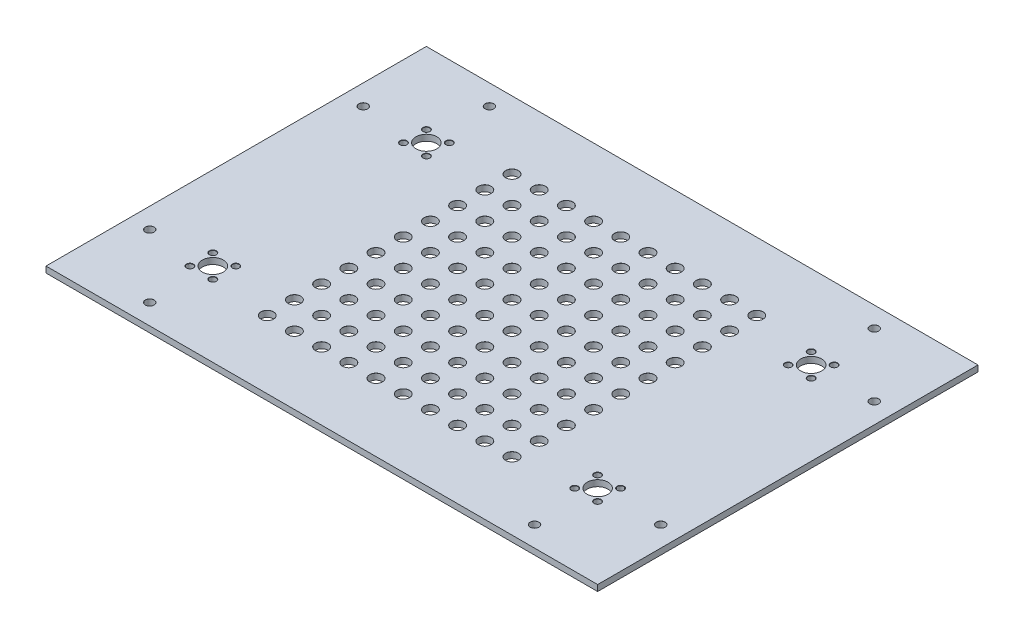
from build123d import *

# Parameters (mm, degrees)
SKETCH1_W                             = 271.8
SKETCH1_H                             = 187.4
SKETCH1_R                             = 5.15
BOSS_EXTRUDE1_DEPTH                   = 3
M3_CLEARANCE_HOLE1_D                  = 3.2
M3_CLEARANCE_HOLE1_CSINK_D            = 3.45
M3_CLEARANCE_HOLE1_CSINK_ANGLE        = 90
M4_CLEARANCE_HOLE2_D                  = 4.3
M4_CLEARANCE_HOLE2_CSINK_D            = 4.35
M4_CLEARANCE_HOLE2_CSINK_ANGLE        = 90
F_6_2_6_2_DIAMETER_HOLE1_AT_2_COUNT   = 2
F_6_2_6_2_DIAMETER_HOLE1_AT_2_PITCH   = 13.4
F_6_2_6_2_DIAMETER_HOLE1_AT_3_COUNT   = 2
F_6_2_6_2_DIAMETER_HOLE1_AT_3_PITCH   = 26.8
F_6_2_6_2_DIAMETER_HOLE1_AT_4_COUNT   = 2
F_6_2_6_2_DIAMETER_HOLE1_AT_4_PITCH   = 40.2
F_6_2_6_2_DIAMETER_HOLE1_AT_5_COUNT   = 2
F_6_2_6_2_DIAMETER_HOLE1_AT_5_PITCH   = 53.6
F_6_2_6_2_DIAMETER_HOLE1_AT_6_COUNT   = 2
F_6_2_6_2_DIAMETER_HOLE1_AT_6_PITCH   = 67
F_6_2_6_2_DIAMETER_HOLE1_AT_7_COUNT   = 2
F_6_2_6_2_DIAMETER_HOLE1_AT_7_PITCH   = 80.4
F_6_2_6_2_DIAMETER_HOLE1_AT_8_COUNT   = 2
F_6_2_6_2_DIAMETER_HOLE1_AT_8_PITCH   = 93.8
F_6_2_6_2_DIAMETER_HOLE1_AT_9_COUNT   = 2
F_6_2_6_2_DIAMETER_HOLE1_AT_9_PITCH   = 107.2
F_6_2_6_2_DIAMETER_HOLE1_AT_10_COUNT  = 2
F_6_2_6_2_DIAMETER_HOLE1_AT_10_PITCH  = 120.6
F_6_2_6_2_DIAMETER_HOLE1_AT_11_COUNT  = 2
F_6_2_6_2_DIAMETER_HOLE1_AT_11_PITCH  = 18.950461736
F_6_2_6_2_DIAMETER_HOLE1_AT_12_COUNT  = 2
F_6_2_6_2_DIAMETER_HOLE1_AT_12_PITCH  = 29.963310898
F_6_2_6_2_DIAMETER_HOLE1_AT_13_COUNT  = 2
F_6_2_6_2_DIAMETER_HOLE1_AT_13_PITCH  = 42.374520646
F_6_2_6_2_DIAMETER_HOLE1_AT_14_COUNT  = 2
F_6_2_6_2_DIAMETER_HOLE1_AT_14_PITCH  = 55.249615383
F_6_2_6_2_DIAMETER_HOLE1_AT_15_COUNT  = 2
F_6_2_6_2_DIAMETER_HOLE1_AT_15_PITCH  = 68.326861482
F_6_2_6_2_DIAMETER_HOLE1_AT_16_COUNT  = 2
F_6_2_6_2_DIAMETER_HOLE1_AT_16_PITCH  = 81.509017906
F_6_2_6_2_DIAMETER_HOLE1_AT_17_COUNT  = 2
F_6_2_6_2_DIAMETER_HOLE1_AT_17_PITCH  = 94.752308679
F_6_2_6_2_DIAMETER_HOLE1_AT_18_COUNT  = 2
F_6_2_6_2_DIAMETER_HOLE1_AT_18_PITCH  = 108.034253827
F_6_2_6_2_DIAMETER_HOLE1_AT_19_COUNT  = 2
F_6_2_6_2_DIAMETER_HOLE1_AT_19_PITCH  = 121.342160851
F_6_2_6_2_DIAMETER_HOLE1_AT_20_COUNT  = 2
F_6_2_6_2_DIAMETER_HOLE1_AT_20_PITCH  = 29.963310898
F_6_2_6_2_DIAMETER_HOLE1_AT_21_COUNT  = 2
F_6_2_6_2_DIAMETER_HOLE1_AT_21_PITCH  = 37.900923472
F_6_2_6_2_DIAMETER_HOLE1_AT_22_COUNT  = 2
F_6_2_6_2_DIAMETER_HOLE1_AT_22_PITCH  = 48.314387091
F_6_2_6_2_DIAMETER_HOLE1_AT_23_COUNT  = 2
F_6_2_6_2_DIAMETER_HOLE1_AT_23_PITCH  = 59.926621797
F_6_2_6_2_DIAMETER_HOLE1_AT_24_COUNT  = 2
F_6_2_6_2_DIAMETER_HOLE1_AT_24_PITCH  = 72.161208416
F_6_2_6_2_DIAMETER_HOLE1_AT_25_COUNT  = 2
F_6_2_6_2_DIAMETER_HOLE1_AT_25_PITCH  = 84.749041293
F_6_2_6_2_DIAMETER_HOLE1_AT_26_COUNT  = 2
F_6_2_6_2_DIAMETER_HOLE1_AT_26_PITCH  = 97.553472516
F_6_2_6_2_DIAMETER_HOLE1_AT_27_COUNT  = 2
F_6_2_6_2_DIAMETER_HOLE1_AT_27_PITCH  = 110.499230767
F_6_2_6_2_DIAMETER_HOLE1_AT_28_COUNT  = 2
F_6_2_6_2_DIAMETER_HOLE1_AT_28_PITCH  = 123.541895728
F_6_2_6_2_DIAMETER_HOLE1_AT_29_COUNT  = 2
F_6_2_6_2_DIAMETER_HOLE1_AT_29_PITCH  = 42.374520646
F_6_2_6_2_DIAMETER_HOLE1_AT_30_COUNT  = 2
F_6_2_6_2_DIAMETER_HOLE1_AT_30_PITCH  = 48.314387091
F_6_2_6_2_DIAMETER_HOLE1_AT_31_COUNT  = 2
F_6_2_6_2_DIAMETER_HOLE1_AT_31_PITCH  = 56.851385207
F_6_2_6_2_DIAMETER_HOLE1_AT_32_COUNT  = 2
F_6_2_6_2_DIAMETER_HOLE1_AT_32_PITCH  = 67
F_6_2_6_2_DIAMETER_HOLE1_AT_33_COUNT  = 2
F_6_2_6_2_DIAMETER_HOLE1_AT_33_PITCH  = 78.134755391
F_6_2_6_2_DIAMETER_HOLE1_AT_34_COUNT  = 2
F_6_2_6_2_DIAMETER_HOLE1_AT_34_PITCH  = 89.889932695
F_6_2_6_2_DIAMETER_HOLE1_AT_35_COUNT  = 2
F_6_2_6_2_DIAMETER_HOLE1_AT_35_PITCH  = 102.051359619
F_6_2_6_2_DIAMETER_HOLE1_AT_36_COUNT  = 2
F_6_2_6_2_DIAMETER_HOLE1_AT_36_PITCH  = 114.489650187
F_6_2_6_2_DIAMETER_HOLE1_AT_37_COUNT  = 2
F_6_2_6_2_DIAMETER_HOLE1_AT_37_PITCH  = 127.123561939
F_6_2_6_2_DIAMETER_HOLE1_AT_38_COUNT  = 2
F_6_2_6_2_DIAMETER_HOLE1_AT_38_PITCH  = 55.249615383
F_6_2_6_2_DIAMETER_HOLE1_AT_39_COUNT  = 2
F_6_2_6_2_DIAMETER_HOLE1_AT_39_PITCH  = 59.926621797
F_6_2_6_2_DIAMETER_HOLE1_AT_40_COUNT  = 2
F_6_2_6_2_DIAMETER_HOLE1_AT_40_PITCH  = 67
F_6_2_6_2_DIAMETER_HOLE1_AT_41_COUNT  = 2
F_6_2_6_2_DIAMETER_HOLE1_AT_41_PITCH  = 75.801846943
F_6_2_6_2_DIAMETER_HOLE1_AT_42_COUNT  = 2
F_6_2_6_2_DIAMETER_HOLE1_AT_42_PITCH  = 85.801864782
F_6_2_6_2_DIAMETER_HOLE1_AT_43_COUNT  = 2
F_6_2_6_2_DIAMETER_HOLE1_AT_43_PITCH  = 96.628774182
F_6_2_6_2_DIAMETER_HOLE1_AT_44_COUNT  = 2
F_6_2_6_2_DIAMETER_HOLE1_AT_44_PITCH  = 108.034253827
F_6_2_6_2_DIAMETER_HOLE1_AT_45_COUNT  = 2
F_6_2_6_2_DIAMETER_HOLE1_AT_45_PITCH  = 119.853243594
F_6_2_6_2_DIAMETER_HOLE1_AT_46_COUNT  = 2
F_6_2_6_2_DIAMETER_HOLE1_AT_46_PITCH  = 131.974694544
F_6_2_6_2_DIAMETER_HOLE1_AT_47_COUNT  = 2
F_6_2_6_2_DIAMETER_HOLE1_AT_47_PITCH  = 68.326861482
F_6_2_6_2_DIAMETER_HOLE1_AT_48_COUNT  = 2
F_6_2_6_2_DIAMETER_HOLE1_AT_48_PITCH  = 72.161208416
F_6_2_6_2_DIAMETER_HOLE1_AT_49_COUNT  = 2
F_6_2_6_2_DIAMETER_HOLE1_AT_49_PITCH  = 78.134755391
F_6_2_6_2_DIAMETER_HOLE1_AT_50_COUNT  = 2
F_6_2_6_2_DIAMETER_HOLE1_AT_50_PITCH  = 85.801864782
F_6_2_6_2_DIAMETER_HOLE1_AT_51_COUNT  = 2
F_6_2_6_2_DIAMETER_HOLE1_AT_51_PITCH  = 94.752308679
F_6_2_6_2_DIAMETER_HOLE1_AT_52_COUNT  = 2
F_6_2_6_2_DIAMETER_HOLE1_AT_52_PITCH  = 104.657345657
F_6_2_6_2_DIAMETER_HOLE1_AT_53_COUNT  = 2
F_6_2_6_2_DIAMETER_HOLE1_AT_53_PITCH  = 115.271158578
F_6_2_6_2_DIAMETER_HOLE1_AT_54_COUNT  = 2
F_6_2_6_2_DIAMETER_HOLE1_AT_54_PITCH  = 126.41534717
F_6_2_6_2_DIAMETER_HOLE1_AT_55_COUNT  = 2
F_6_2_6_2_DIAMETER_HOLE1_AT_55_PITCH  = 137.961443889
F_6_2_6_2_DIAMETER_HOLE1_AT_56_COUNT  = 2
F_6_2_6_2_DIAMETER_HOLE1_AT_56_PITCH  = 81.509017906
F_6_2_6_2_DIAMETER_HOLE1_AT_57_COUNT  = 2
F_6_2_6_2_DIAMETER_HOLE1_AT_57_PITCH  = 84.749041293
F_6_2_6_2_DIAMETER_HOLE1_AT_58_COUNT  = 2
F_6_2_6_2_DIAMETER_HOLE1_AT_58_PITCH  = 89.889932695
F_6_2_6_2_DIAMETER_HOLE1_AT_59_COUNT  = 2
F_6_2_6_2_DIAMETER_HOLE1_AT_59_PITCH  = 96.628774182
F_6_2_6_2_DIAMETER_HOLE1_AT_60_COUNT  = 2
F_6_2_6_2_DIAMETER_HOLE1_AT_60_PITCH  = 104.657345657
F_6_2_6_2_DIAMETER_HOLE1_AT_61_COUNT  = 2
F_6_2_6_2_DIAMETER_HOLE1_AT_61_PITCH  = 113.702770415
F_6_2_6_2_DIAMETER_HOLE1_AT_62_COUNT  = 2
F_6_2_6_2_DIAMETER_HOLE1_AT_62_PITCH  = 123.541895728
F_6_2_6_2_DIAMETER_HOLE1_AT_63_COUNT  = 2
F_6_2_6_2_DIAMETER_HOLE1_AT_63_PITCH  = 134
F_6_2_6_2_DIAMETER_HOLE1_AT_64_COUNT  = 2
F_6_2_6_2_DIAMETER_HOLE1_AT_64_PITCH  = 144.943161274
F_6_2_6_2_DIAMETER_HOLE1_AT_65_COUNT  = 2
F_6_2_6_2_DIAMETER_HOLE1_AT_65_PITCH  = 94.752308679
F_6_2_6_2_DIAMETER_HOLE1_AT_66_COUNT  = 2
F_6_2_6_2_DIAMETER_HOLE1_AT_66_PITCH  = 97.553472516
F_6_2_6_2_DIAMETER_HOLE1_AT_67_COUNT  = 2
F_6_2_6_2_DIAMETER_HOLE1_AT_67_PITCH  = 102.051359619
F_6_2_6_2_DIAMETER_HOLE1_AT_68_COUNT  = 2
F_6_2_6_2_DIAMETER_HOLE1_AT_68_PITCH  = 108.034253827
F_6_2_6_2_DIAMETER_HOLE1_AT_69_COUNT  = 2
F_6_2_6_2_DIAMETER_HOLE1_AT_69_PITCH  = 115.271158578
F_6_2_6_2_DIAMETER_HOLE1_AT_70_COUNT  = 2
F_6_2_6_2_DIAMETER_HOLE1_AT_70_PITCH  = 123.541895728
F_6_2_6_2_DIAMETER_HOLE1_AT_71_COUNT  = 2
F_6_2_6_2_DIAMETER_HOLE1_AT_71_PITCH  = 132.653232151
F_6_2_6_2_DIAMETER_HOLE1_AT_72_COUNT  = 2
F_6_2_6_2_DIAMETER_HOLE1_AT_72_PITCH  = 142.443953891
F_6_2_6_2_DIAMETER_HOLE1_AT_73_COUNT  = 2
F_6_2_6_2_DIAMETER_HOLE1_AT_73_PITCH  = 152.783506963
F_6_2_6_2_DIAMETER_HOLE1_AT_74_COUNT  = 2
F_6_2_6_2_DIAMETER_HOLE1_AT_74_PITCH  = 108.034253827
F_6_2_6_2_DIAMETER_HOLE1_AT_75_COUNT  = 2
F_6_2_6_2_DIAMETER_HOLE1_AT_75_PITCH  = 110.499230767
F_6_2_6_2_DIAMETER_HOLE1_AT_76_COUNT  = 2
F_6_2_6_2_DIAMETER_HOLE1_AT_76_PITCH  = 114.489650187
F_6_2_6_2_DIAMETER_HOLE1_AT_77_COUNT  = 2
F_6_2_6_2_DIAMETER_HOLE1_AT_77_PITCH  = 119.853243594
F_6_2_6_2_DIAMETER_HOLE1_AT_78_COUNT  = 2
F_6_2_6_2_DIAMETER_HOLE1_AT_78_PITCH  = 126.41534717
F_6_2_6_2_DIAMETER_HOLE1_AT_79_COUNT  = 2
F_6_2_6_2_DIAMETER_HOLE1_AT_79_PITCH  = 134
F_6_2_6_2_DIAMETER_HOLE1_AT_80_COUNT  = 2
F_6_2_6_2_DIAMETER_HOLE1_AT_80_PITCH  = 142.443953891
F_6_2_6_2_DIAMETER_HOLE1_AT_81_COUNT  = 2
F_6_2_6_2_DIAMETER_HOLE1_AT_81_PITCH  = 151.603693886
F_6_2_6_2_DIAMETER_HOLE1_AT_82_COUNT  = 2
F_6_2_6_2_DIAMETER_HOLE1_AT_82_PITCH  = 161.357367356
F_6_2_6_2_DIAMETER_HOLE1_AT_83_COUNT  = 2
F_6_2_6_2_DIAMETER_HOLE1_AT_83_PITCH  = 121.342160851
F_6_2_6_2_DIAMETER_HOLE1_AT_84_COUNT  = 2
F_6_2_6_2_DIAMETER_HOLE1_AT_84_PITCH  = 123.541895728
F_6_2_6_2_DIAMETER_HOLE1_AT_85_COUNT  = 2
F_6_2_6_2_DIAMETER_HOLE1_AT_85_PITCH  = 127.123561939
F_6_2_6_2_DIAMETER_HOLE1_AT_86_COUNT  = 2
F_6_2_6_2_DIAMETER_HOLE1_AT_86_PITCH  = 131.974694544
F_6_2_6_2_DIAMETER_HOLE1_AT_87_COUNT  = 2
F_6_2_6_2_DIAMETER_HOLE1_AT_87_PITCH  = 137.961443889
F_6_2_6_2_DIAMETER_HOLE1_AT_88_COUNT  = 2
F_6_2_6_2_DIAMETER_HOLE1_AT_88_PITCH  = 144.943161274
F_6_2_6_2_DIAMETER_HOLE1_AT_89_COUNT  = 2
F_6_2_6_2_DIAMETER_HOLE1_AT_89_PITCH  = 152.783506963
F_6_2_6_2_DIAMETER_HOLE1_AT_90_COUNT  = 2
F_6_2_6_2_DIAMETER_HOLE1_AT_90_PITCH  = 161.357367356
F_6_2_6_2_DIAMETER_HOLE1_AT_91_COUNT  = 2
F_6_2_6_2_DIAMETER_HOLE1_AT_91_PITCH  = 170.554155622
F_6_2_6_2_DIAMETER_HOLE1_AT_92_COUNT  = 2
F_6_2_6_2_DIAMETER_HOLE1_AT_92_PITCH  = 13.4
F_6_2_6_2_DIAMETER_HOLE1_AT_93_COUNT  = 2
F_6_2_6_2_DIAMETER_HOLE1_AT_93_PITCH  = 26.8
F_6_2_6_2_DIAMETER_HOLE1_AT_94_COUNT  = 2
F_6_2_6_2_DIAMETER_HOLE1_AT_94_PITCH  = 40.2
F_6_2_6_2_DIAMETER_HOLE1_AT_95_COUNT  = 2
F_6_2_6_2_DIAMETER_HOLE1_AT_95_PITCH  = 53.6
F_6_2_6_2_DIAMETER_HOLE1_AT_96_COUNT  = 2
F_6_2_6_2_DIAMETER_HOLE1_AT_96_PITCH  = 67
F_6_2_6_2_DIAMETER_HOLE1_AT_97_COUNT  = 2
F_6_2_6_2_DIAMETER_HOLE1_AT_97_PITCH  = 80.4
F_6_2_6_2_DIAMETER_HOLE1_AT_98_COUNT  = 2
F_6_2_6_2_DIAMETER_HOLE1_AT_98_PITCH  = 93.8
F_6_2_6_2_DIAMETER_HOLE1_AT_99_COUNT  = 2
F_6_2_6_2_DIAMETER_HOLE1_AT_99_PITCH  = 107.2
F_6_2_6_2_DIAMETER_HOLE1_AT_100_COUNT = 2
F_6_2_6_2_DIAMETER_HOLE1_AT_100_PITCH = 120.6


with BuildPart() as part:
    # Sketch1 → Boss-Extrude1 (new body)
    with BuildSketch(Plane(origin=(0, 0, 0), x_dir=(1, 0, 0), z_dir=(0, 1, 0))):
        Rectangle(SKETCH1_W, SKETCH1_H)
        with Locations(Location((-94.8, 52.6, 0), (0, 0, 270))):
            Circle(SKETCH1_R, mode=Mode.SUBTRACT)
        with Locations(Location((-94.8, -52.6, 0), (0, 0, 270))):
            Circle(SKETCH1_R, mode=Mode.SUBTRACT)
        with Locations(Location((94.8, -52.6, 0), (0, 0, 270))):
            Circle(SKETCH1_R, mode=Mode.SUBTRACT)
        with Locations(Location((94.8, 52.6, 0), (0, 0, 270))):
            Circle(SKETCH1_R, mode=Mode.SUBTRACT)
    extrude(amount=BOSS_EXTRUDE1_DEPTH)

    # M3 Clearance Hole1 (through all)
    with Locations(Plane(origin=(0, 3, 0), x_dir=(1, 0, 0), z_dir=(0, 1, 0))):
        with Locations((-89.145, 46.945), (-100.455, 58.255), (-100.455, 46.945), (-89.145, 58.255), (-89.145, -58.255), (-100.455, -46.945), (-100.455, -58.255), (-89.145, -46.945), (89.145, -46.945), (100.455, -58.255), (100.455, -46.945), (89.145, -58.255), (89.145, 58.255), (100.455, 46.945), (100.455, 58.255), (89.145, 46.945)):
            CounterSinkHole(M3_CLEARANCE_HOLE1_D / 2, M3_CLEARANCE_HOLE1_CSINK_D / 2, counter_sink_angle=M3_CLEARANCE_HOLE1_CSINK_ANGLE)

    # M4 Clearance Hole2 (through all)
    with Locations(Plane(origin=(0, 3, 0), x_dir=(1, 0, 0), z_dir=(0, 1, 0))):
        with Locations((-94.8, 83.7), (-125.9, 52.6), (-125.9, -52.6), (-94.8, -83.7), (94.8, -83.7), (125.9, -52.6), (125.9, 52.6), (94.8, 83.7)):
            CounterSinkHole(M4_CLEARANCE_HOLE2_D / 2, M4_CLEARANCE_HOLE2_CSINK_D / 2, counter_sink_angle=M4_CLEARANCE_HOLE2_CSINK_ANGLE)

    # Sketch17 → Ø6.2 (6.2) Diameter Hole1 (revolve, cut)
    with BuildSketch(Plane(origin=(-60.3, 3, -60.3), x_dir=(0, 0, 1), z_dir=(1, 0, 0))):
        Polygon((0, 0), (0, 3), (3.1, 3), (3.1, 0.025), (3.125, 0), align=None)
    f_6_2_6_2_diameter_hole1 = revolve(axis=Axis((-60.3, 9.35, -60.3), (0, -1, 0)), mode=Mode.SUBTRACT)

    # Ø6.2 (6.2) Diameter Hole1 at 2: Ø6.2 (6.2) Diameter Hole1 ×2
    with Locations(*[(i * F_6_2_6_2_DIAMETER_HOLE1_AT_2_PITCH, 0, 0) for i in range(1, F_6_2_6_2_DIAMETER_HOLE1_AT_2_COUNT)]):
        add(f_6_2_6_2_diameter_hole1, mode=Mode.SUBTRACT)

    # Ø6.2 (6.2) Diameter Hole1 at 3: Ø6.2 (6.2) Diameter Hole1 ×2
    with Locations(*[(i * F_6_2_6_2_DIAMETER_HOLE1_AT_3_PITCH, 0, 0) for i in range(1, F_6_2_6_2_DIAMETER_HOLE1_AT_3_COUNT)]):
        add(f_6_2_6_2_diameter_hole1, mode=Mode.SUBTRACT)

    # Ø6.2 (6.2) Diameter Hole1 at 4: Ø6.2 (6.2) Diameter Hole1 ×2
    with Locations(*[(i * F_6_2_6_2_DIAMETER_HOLE1_AT_4_PITCH, 0, 0) for i in range(1, F_6_2_6_2_DIAMETER_HOLE1_AT_4_COUNT)]):
        add(f_6_2_6_2_diameter_hole1, mode=Mode.SUBTRACT)

    # Ø6.2 (6.2) Diameter Hole1 at 5: Ø6.2 (6.2) Diameter Hole1 ×2
    with Locations(*[(i * F_6_2_6_2_DIAMETER_HOLE1_AT_5_PITCH, 0, 0) for i in range(1, F_6_2_6_2_DIAMETER_HOLE1_AT_5_COUNT)]):
        add(f_6_2_6_2_diameter_hole1, mode=Mode.SUBTRACT)

    # Ø6.2 (6.2) Diameter Hole1 at 6: Ø6.2 (6.2) Diameter Hole1 ×2
    with Locations(*[(i * F_6_2_6_2_DIAMETER_HOLE1_AT_6_PITCH, 0, 0) for i in range(1, F_6_2_6_2_DIAMETER_HOLE1_AT_6_COUNT)]):
        add(f_6_2_6_2_diameter_hole1, mode=Mode.SUBTRACT)

    # Ø6.2 (6.2) Diameter Hole1 at 7: Ø6.2 (6.2) Diameter Hole1 ×2
    with Locations(*[(i * F_6_2_6_2_DIAMETER_HOLE1_AT_7_PITCH, 0, 0) for i in range(1, F_6_2_6_2_DIAMETER_HOLE1_AT_7_COUNT)]):
        add(f_6_2_6_2_diameter_hole1, mode=Mode.SUBTRACT)

    # Ø6.2 (6.2) Diameter Hole1 at 8: Ø6.2 (6.2) Diameter Hole1 ×2
    with Locations(*[(i * F_6_2_6_2_DIAMETER_HOLE1_AT_8_PITCH, 0, 0) for i in range(1, F_6_2_6_2_DIAMETER_HOLE1_AT_8_COUNT)]):
        add(f_6_2_6_2_diameter_hole1, mode=Mode.SUBTRACT)

    # Ø6.2 (6.2) Diameter Hole1 at 9: Ø6.2 (6.2) Diameter Hole1 ×2
    with Locations(*[(i * F_6_2_6_2_DIAMETER_HOLE1_AT_9_PITCH, 0, 0) for i in range(1, F_6_2_6_2_DIAMETER_HOLE1_AT_9_COUNT)]):
        add(f_6_2_6_2_diameter_hole1, mode=Mode.SUBTRACT)

    # Ø6.2 (6.2) Diameter Hole1 at 10: Ø6.2 (6.2) Diameter Hole1 ×2
    with Locations(*[(i * F_6_2_6_2_DIAMETER_HOLE1_AT_10_PITCH, 0, 0) for i in range(1, F_6_2_6_2_DIAMETER_HOLE1_AT_10_COUNT)]):
        add(f_6_2_6_2_diameter_hole1, mode=Mode.SUBTRACT)

    # Ø6.2 (6.2) Diameter Hole1 at 11: Ø6.2 (6.2) Diameter Hole1 ×2
    with Locations(*[Vector(0.7071067811865476, 0, 0.7071067811865476) * (i * F_6_2_6_2_DIAMETER_HOLE1_AT_11_PITCH) for i in range(1, F_6_2_6_2_DIAMETER_HOLE1_AT_11_COUNT)]):
        add(f_6_2_6_2_diameter_hole1, mode=Mode.SUBTRACT)

    # Ø6.2 (6.2) Diameter Hole1 at 12: Ø6.2 (6.2) Diameter Hole1 ×2
    with Locations(*[Vector(0.8944271909999151, 0, 0.44721359549995976) * (i * F_6_2_6_2_DIAMETER_HOLE1_AT_12_PITCH) for i in range(1, F_6_2_6_2_DIAMETER_HOLE1_AT_12_COUNT)]):
        add(f_6_2_6_2_diameter_hole1, mode=Mode.SUBTRACT)

    # Ø6.2 (6.2) Diameter Hole1 at 13: Ø6.2 (6.2) Diameter Hole1 ×2
    with Locations(*[Vector(0.9486832980505132, 0, 0.31622776601683994) * (i * F_6_2_6_2_DIAMETER_HOLE1_AT_13_PITCH) for i in range(1, F_6_2_6_2_DIAMETER_HOLE1_AT_13_COUNT)]):
        add(f_6_2_6_2_diameter_hole1, mode=Mode.SUBTRACT)

    # Ø6.2 (6.2) Diameter Hole1 at 14: Ø6.2 (6.2) Diameter Hole1 ×2
    with Locations(*[Vector(0.9701425001453315, 0, 0.24253562503633475) * (i * F_6_2_6_2_DIAMETER_HOLE1_AT_14_PITCH) for i in range(1, F_6_2_6_2_DIAMETER_HOLE1_AT_14_COUNT)]):
        add(f_6_2_6_2_diameter_hole1, mode=Mode.SUBTRACT)

    # Ø6.2 (6.2) Diameter Hole1 at 15: Ø6.2 (6.2) Diameter Hole1 ×2
    with Locations(*[Vector(0.9805806756909199, 0, 0.1961161351381856) * (i * F_6_2_6_2_DIAMETER_HOLE1_AT_15_PITCH) for i in range(1, F_6_2_6_2_DIAMETER_HOLE1_AT_15_COUNT)]):
        add(f_6_2_6_2_diameter_hole1, mode=Mode.SUBTRACT)

    # Ø6.2 (6.2) Diameter Hole1 at 16: Ø6.2 (6.2) Diameter Hole1 ×2
    with Locations(*[Vector(0.9863939238321435, 0, 0.16439898730535868) * (i * F_6_2_6_2_DIAMETER_HOLE1_AT_16_PITCH) for i in range(1, F_6_2_6_2_DIAMETER_HOLE1_AT_16_COUNT)]):
        add(f_6_2_6_2_diameter_hole1, mode=Mode.SUBTRACT)

    # Ø6.2 (6.2) Diameter Hole1 at 17: Ø6.2 (6.2) Diameter Hole1 ×2
    with Locations(*[Vector(0.9899494936611665, 0, 0.14142135623731072) * (i * F_6_2_6_2_DIAMETER_HOLE1_AT_17_PITCH) for i in range(1, F_6_2_6_2_DIAMETER_HOLE1_AT_17_COUNT)]):
        add(f_6_2_6_2_diameter_hole1, mode=Mode.SUBTRACT)

    # Ø6.2 (6.2) Diameter Hole1 at 18: Ø6.2 (6.2) Diameter Hole1 ×2
    with Locations(*[Vector(0.9922778767136675, 0, 0.12403473458920956) * (i * F_6_2_6_2_DIAMETER_HOLE1_AT_18_PITCH) for i in range(1, F_6_2_6_2_DIAMETER_HOLE1_AT_18_COUNT)]):
        add(f_6_2_6_2_diameter_hole1, mode=Mode.SUBTRACT)

    # Ø6.2 (6.2) Diameter Hole1 at 19: Ø6.2 (6.2) Diameter Hole1 ×2
    with Locations(*[Vector(0.9938837346736188, 0, 0.11043152607484753) * (i * F_6_2_6_2_DIAMETER_HOLE1_AT_19_PITCH) for i in range(1, F_6_2_6_2_DIAMETER_HOLE1_AT_19_COUNT)]):
        add(f_6_2_6_2_diameter_hole1, mode=Mode.SUBTRACT)

    # Ø6.2 (6.2) Diameter Hole1 at 20: Ø6.2 (6.2) Diameter Hole1 ×2
    with Locations(*[Vector(0.44721359549996165, 0, 0.8944271909999141) * (i * F_6_2_6_2_DIAMETER_HOLE1_AT_20_PITCH) for i in range(1, F_6_2_6_2_DIAMETER_HOLE1_AT_20_COUNT)]):
        add(f_6_2_6_2_diameter_hole1, mode=Mode.SUBTRACT)

    # Ø6.2 (6.2) Diameter Hole1 at 21: Ø6.2 (6.2) Diameter Hole1 ×2
    with Locations(*[Vector(0.7071067811865476, 0, 0.7071067811865476) * (i * F_6_2_6_2_DIAMETER_HOLE1_AT_21_PITCH) for i in range(1, F_6_2_6_2_DIAMETER_HOLE1_AT_21_COUNT)]):
        add(f_6_2_6_2_diameter_hole1, mode=Mode.SUBTRACT)

    # Ø6.2 (6.2) Diameter Hole1 at 22: Ø6.2 (6.2) Diameter Hole1 ×2
    with Locations(*[Vector(0.8320502943378428, 0, 0.5547001962252305) * (i * F_6_2_6_2_DIAMETER_HOLE1_AT_22_PITCH) for i in range(1, F_6_2_6_2_DIAMETER_HOLE1_AT_22_COUNT)]):
        add(f_6_2_6_2_diameter_hole1, mode=Mode.SUBTRACT)

    # Ø6.2 (6.2) Diameter Hole1 at 23: Ø6.2 (6.2) Diameter Hole1 ×2
    with Locations(*[Vector(0.894427190999915, 0, 0.4472135954999598) * (i * F_6_2_6_2_DIAMETER_HOLE1_AT_23_PITCH) for i in range(1, F_6_2_6_2_DIAMETER_HOLE1_AT_23_COUNT)]):
        add(f_6_2_6_2_diameter_hole1, mode=Mode.SUBTRACT)

    # Ø6.2 (6.2) Diameter Hole1 at 24: Ø6.2 (6.2) Diameter Hole1 ×2
    with Locations(*[Vector(0.9284766908852585, 0, 0.3713906763541058) * (i * F_6_2_6_2_DIAMETER_HOLE1_AT_24_PITCH) for i in range(1, F_6_2_6_2_DIAMETER_HOLE1_AT_24_COUNT)]):
        add(f_6_2_6_2_diameter_hole1, mode=Mode.SUBTRACT)

    # Ø6.2 (6.2) Diameter Hole1 at 25: Ø6.2 (6.2) Diameter Hole1 ×2
    with Locations(*[Vector(0.9486832980505131, 0, 0.31622776601684) * (i * F_6_2_6_2_DIAMETER_HOLE1_AT_25_PITCH) for i in range(1, F_6_2_6_2_DIAMETER_HOLE1_AT_25_COUNT)]):
        add(f_6_2_6_2_diameter_hole1, mode=Mode.SUBTRACT)

    # Ø6.2 (6.2) Diameter Hole1 at 26: Ø6.2 (6.2) Diameter Hole1 ×2
    with Locations(*[Vector(0.9615239476408227, 0, 0.27472112789737996) * (i * F_6_2_6_2_DIAMETER_HOLE1_AT_26_PITCH) for i in range(1, F_6_2_6_2_DIAMETER_HOLE1_AT_26_COUNT)]):
        add(f_6_2_6_2_diameter_hole1, mode=Mode.SUBTRACT)

    # Ø6.2 (6.2) Diameter Hole1 at 27: Ø6.2 (6.2) Diameter Hole1 ×2
    with Locations(*[Vector(0.9701425001453315, 0, 0.2425356250363348) * (i * F_6_2_6_2_DIAMETER_HOLE1_AT_27_PITCH) for i in range(1, F_6_2_6_2_DIAMETER_HOLE1_AT_27_COUNT)]):
        add(f_6_2_6_2_diameter_hole1, mode=Mode.SUBTRACT)

    # Ø6.2 (6.2) Diameter Hole1 at 28: Ø6.2 (6.2) Diameter Hole1 ×2
    with Locations(*[Vector(0.9761870601839524, 0, 0.21693045781865788) * (i * F_6_2_6_2_DIAMETER_HOLE1_AT_28_PITCH) for i in range(1, F_6_2_6_2_DIAMETER_HOLE1_AT_28_COUNT)]):
        add(f_6_2_6_2_diameter_hole1, mode=Mode.SUBTRACT)

    # Ø6.2 (6.2) Diameter Hole1 at 29: Ø6.2 (6.2) Diameter Hole1 ×2
    with Locations(*[Vector(0.3162277660168438, 0, 0.9486832980505119) * (i * F_6_2_6_2_DIAMETER_HOLE1_AT_29_PITCH) for i in range(1, F_6_2_6_2_DIAMETER_HOLE1_AT_29_COUNT)]):
        add(f_6_2_6_2_diameter_hole1, mode=Mode.SUBTRACT)

    # Ø6.2 (6.2) Diameter Hole1 at 30: Ø6.2 (6.2) Diameter Hole1 ×2
    with Locations(*[Vector(0.5547001962252313, 0, 0.8320502943378424) * (i * F_6_2_6_2_DIAMETER_HOLE1_AT_30_PITCH) for i in range(1, F_6_2_6_2_DIAMETER_HOLE1_AT_30_COUNT)]):
        add(f_6_2_6_2_diameter_hole1, mode=Mode.SUBTRACT)

    # Ø6.2 (6.2) Diameter Hole1 at 31: Ø6.2 (6.2) Diameter Hole1 ×2
    with Locations(*[Vector(0.7071067811865476, 0, 0.7071067811865476) * (i * F_6_2_6_2_DIAMETER_HOLE1_AT_31_PITCH) for i in range(1, F_6_2_6_2_DIAMETER_HOLE1_AT_31_COUNT)]):
        add(f_6_2_6_2_diameter_hole1, mode=Mode.SUBTRACT)

    # Ø6.2 (6.2) Diameter Hole1 at 32: Ø6.2 (6.2) Diameter Hole1 ×2
    with Locations(*[Vector(0.7999999999999993, 0, 0.600000000000001) * (i * F_6_2_6_2_DIAMETER_HOLE1_AT_32_PITCH) for i in range(1, F_6_2_6_2_DIAMETER_HOLE1_AT_32_COUNT)]):
        add(f_6_2_6_2_diameter_hole1, mode=Mode.SUBTRACT)

    # Ø6.2 (6.2) Diameter Hole1 at 33: Ø6.2 (6.2) Diameter Hole1 ×2
    with Locations(*[Vector(0.8574929257125433, 0, 0.514495755427528) * (i * F_6_2_6_2_DIAMETER_HOLE1_AT_33_PITCH) for i in range(1, F_6_2_6_2_DIAMETER_HOLE1_AT_33_COUNT)]):
        add(f_6_2_6_2_diameter_hole1, mode=Mode.SUBTRACT)

    # Ø6.2 (6.2) Diameter Hole1 at 34: Ø6.2 (6.2) Diameter Hole1 ×2
    with Locations(*[Vector(0.894427190999915, 0, 0.44721359549995976) * (i * F_6_2_6_2_DIAMETER_HOLE1_AT_34_PITCH) for i in range(1, F_6_2_6_2_DIAMETER_HOLE1_AT_34_COUNT)]):
        add(f_6_2_6_2_diameter_hole1, mode=Mode.SUBTRACT)

    # Ø6.2 (6.2) Diameter Hole1 at 35: Ø6.2 (6.2) Diameter Hole1 ×2
    with Locations(*[Vector(0.9191450300180571, 0, 0.3939192985791697) * (i * F_6_2_6_2_DIAMETER_HOLE1_AT_35_PITCH) for i in range(1, F_6_2_6_2_DIAMETER_HOLE1_AT_35_COUNT)]):
        add(f_6_2_6_2_diameter_hole1, mode=Mode.SUBTRACT)

    # Ø6.2 (6.2) Diameter Hole1 at 36: Ø6.2 (6.2) Diameter Hole1 ×2
    with Locations(*[Vector(0.9363291775690439, 0, 0.3511234415883937) * (i * F_6_2_6_2_DIAMETER_HOLE1_AT_36_PITCH) for i in range(1, F_6_2_6_2_DIAMETER_HOLE1_AT_36_COUNT)]):
        add(f_6_2_6_2_diameter_hole1, mode=Mode.SUBTRACT)

    # Ø6.2 (6.2) Diameter Hole1 at 37: Ø6.2 (6.2) Diameter Hole1 ×2
    with Locations(*[Vector(0.9486832980505132, 0, 0.3162277660168399) * (i * F_6_2_6_2_DIAMETER_HOLE1_AT_37_PITCH) for i in range(1, F_6_2_6_2_DIAMETER_HOLE1_AT_37_COUNT)]):
        add(f_6_2_6_2_diameter_hole1, mode=Mode.SUBTRACT)

    # Ø6.2 (6.2) Diameter Hole1 at 38: Ø6.2 (6.2) Diameter Hole1 ×2
    with Locations(*[Vector(0.24253562503634007, 0, 0.9701425001453301) * (i * F_6_2_6_2_DIAMETER_HOLE1_AT_38_PITCH) for i in range(1, F_6_2_6_2_DIAMETER_HOLE1_AT_38_COUNT)]):
        add(f_6_2_6_2_diameter_hole1, mode=Mode.SUBTRACT)

    # Ø6.2 (6.2) Diameter Hole1 at 39: Ø6.2 (6.2) Diameter Hole1 ×2
    with Locations(*[Vector(0.4472135954999617, 0, 0.8944271909999141) * (i * F_6_2_6_2_DIAMETER_HOLE1_AT_39_PITCH) for i in range(1, F_6_2_6_2_DIAMETER_HOLE1_AT_39_COUNT)]):
        add(f_6_2_6_2_diameter_hole1, mode=Mode.SUBTRACT)

    # Ø6.2 (6.2) Diameter Hole1 at 40: Ø6.2 (6.2) Diameter Hole1 ×2
    with Locations(*[Vector(0.6000000000000013, 0, 0.7999999999999992) * (i * F_6_2_6_2_DIAMETER_HOLE1_AT_40_PITCH) for i in range(1, F_6_2_6_2_DIAMETER_HOLE1_AT_40_COUNT)]):
        add(f_6_2_6_2_diameter_hole1, mode=Mode.SUBTRACT)

    # Ø6.2 (6.2) Diameter Hole1 at 41: Ø6.2 (6.2) Diameter Hole1 ×2
    with Locations(*[Vector(0.7071067811865476, 0, 0.7071067811865476) * (i * F_6_2_6_2_DIAMETER_HOLE1_AT_41_PITCH) for i in range(1, F_6_2_6_2_DIAMETER_HOLE1_AT_41_COUNT)]):
        add(f_6_2_6_2_diameter_hole1, mode=Mode.SUBTRACT)

    # Ø6.2 (6.2) Diameter Hole1 at 42: Ø6.2 (6.2) Diameter Hole1 ×2
    with Locations(*[Vector(0.7808688094430297, 0, 0.6246950475544251) * (i * F_6_2_6_2_DIAMETER_HOLE1_AT_42_PITCH) for i in range(1, F_6_2_6_2_DIAMETER_HOLE1_AT_42_COUNT)]):
        add(f_6_2_6_2_diameter_hole1, mode=Mode.SUBTRACT)

    # Ø6.2 (6.2) Diameter Hole1 at 43: Ø6.2 (6.2) Diameter Hole1 ×2
    with Locations(*[Vector(0.8320502943378428, 0, 0.5547001962252305) * (i * F_6_2_6_2_DIAMETER_HOLE1_AT_43_PITCH) for i in range(1, F_6_2_6_2_DIAMETER_HOLE1_AT_43_COUNT)]):
        add(f_6_2_6_2_diameter_hole1, mode=Mode.SUBTRACT)

    # Ø6.2 (6.2) Diameter Hole1 at 44: Ø6.2 (6.2) Diameter Hole1 ×2
    with Locations(*[Vector(0.8682431421244583, 0, 0.4961389383568355) * (i * F_6_2_6_2_DIAMETER_HOLE1_AT_44_PITCH) for i in range(1, F_6_2_6_2_DIAMETER_HOLE1_AT_44_COUNT)]):
        add(f_6_2_6_2_diameter_hole1, mode=Mode.SUBTRACT)

    # Ø6.2 (6.2) Diameter Hole1 at 45: Ø6.2 (6.2) Diameter Hole1 ×2
    with Locations(*[Vector(0.894427190999915, 0, 0.44721359549995976) * (i * F_6_2_6_2_DIAMETER_HOLE1_AT_45_PITCH) for i in range(1, F_6_2_6_2_DIAMETER_HOLE1_AT_45_COUNT)]):
        add(f_6_2_6_2_diameter_hole1, mode=Mode.SUBTRACT)

    # Ø6.2 (6.2) Diameter Hole1 at 46: Ø6.2 (6.2) Diameter Hole1 ×2
    with Locations(*[Vector(0.9138115486202563, 0, 0.40613846605344955) * (i * F_6_2_6_2_DIAMETER_HOLE1_AT_46_PITCH) for i in range(1, F_6_2_6_2_DIAMETER_HOLE1_AT_46_COUNT)]):
        add(f_6_2_6_2_diameter_hole1, mode=Mode.SUBTRACT)

    # Ø6.2 (6.2) Diameter Hole1 at 47: Ø6.2 (6.2) Diameter Hole1 ×2
    with Locations(*[Vector(0.19611613513819182, 0, 0.9805806756909187) * (i * F_6_2_6_2_DIAMETER_HOLE1_AT_47_PITCH) for i in range(1, F_6_2_6_2_DIAMETER_HOLE1_AT_47_COUNT)]):
        add(f_6_2_6_2_diameter_hole1, mode=Mode.SUBTRACT)

    # Ø6.2 (6.2) Diameter Hole1 at 48: Ø6.2 (6.2) Diameter Hole1 ×2
    with Locations(*[Vector(0.3713906763541087, 0, 0.9284766908852573) * (i * F_6_2_6_2_DIAMETER_HOLE1_AT_48_PITCH) for i in range(1, F_6_2_6_2_DIAMETER_HOLE1_AT_48_COUNT)]):
        add(f_6_2_6_2_diameter_hole1, mode=Mode.SUBTRACT)

    # Ø6.2 (6.2) Diameter Hole1 at 49: Ø6.2 (6.2) Diameter Hole1 ×2
    with Locations(*[Vector(0.5144957554275291, 0, 0.8574929257125427) * (i * F_6_2_6_2_DIAMETER_HOLE1_AT_49_PITCH) for i in range(1, F_6_2_6_2_DIAMETER_HOLE1_AT_49_COUNT)]):
        add(f_6_2_6_2_diameter_hole1, mode=Mode.SUBTRACT)

    # Ø6.2 (6.2) Diameter Hole1 at 50: Ø6.2 (6.2) Diameter Hole1 ×2
    with Locations(*[Vector(0.6246950475544253, 0, 0.7808688094430295) * (i * F_6_2_6_2_DIAMETER_HOLE1_AT_50_PITCH) for i in range(1, F_6_2_6_2_DIAMETER_HOLE1_AT_50_COUNT)]):
        add(f_6_2_6_2_diameter_hole1, mode=Mode.SUBTRACT)

    # Ø6.2 (6.2) Diameter Hole1 at 51: Ø6.2 (6.2) Diameter Hole1 ×2
    with Locations(*[Vector(0.7071067811865476, 0, 0.7071067811865476) * (i * F_6_2_6_2_DIAMETER_HOLE1_AT_51_PITCH) for i in range(1, F_6_2_6_2_DIAMETER_HOLE1_AT_51_COUNT)]):
        add(f_6_2_6_2_diameter_hole1, mode=Mode.SUBTRACT)

    # Ø6.2 (6.2) Diameter Hole1 at 52: Ø6.2 (6.2) Diameter Hole1 ×2
    with Locations(*[Vector(0.7682212795973753, 0, 0.6401843996644805) * (i * F_6_2_6_2_DIAMETER_HOLE1_AT_52_PITCH) for i in range(1, F_6_2_6_2_DIAMETER_HOLE1_AT_52_COUNT)]):
        add(f_6_2_6_2_diameter_hole1, mode=Mode.SUBTRACT)

    # Ø6.2 (6.2) Diameter Hole1 at 53: Ø6.2 (6.2) Diameter Hole1 ×2
    with Locations(*[Vector(0.8137334712067342, 0, 0.5812381937190976) * (i * F_6_2_6_2_DIAMETER_HOLE1_AT_53_PITCH) for i in range(1, F_6_2_6_2_DIAMETER_HOLE1_AT_53_COUNT)]):
        add(f_6_2_6_2_diameter_hole1, mode=Mode.SUBTRACT)

    # Ø6.2 (6.2) Diameter Hole1 at 54: Ø6.2 (6.2) Diameter Hole1 ×2
    with Locations(*[Vector(0.847998304005087, 0, 0.5299989400031815) * (i * F_6_2_6_2_DIAMETER_HOLE1_AT_54_PITCH) for i in range(1, F_6_2_6_2_DIAMETER_HOLE1_AT_54_COUNT)]):
        add(f_6_2_6_2_diameter_hole1, mode=Mode.SUBTRACT)

    # Ø6.2 (6.2) Diameter Hole1 at 55: Ø6.2 (6.2) Diameter Hole1 ×2
    with Locations(*[Vector(0.8741572761215368, 0, 0.48564293117863383) * (i * F_6_2_6_2_DIAMETER_HOLE1_AT_55_PITCH) for i in range(1, F_6_2_6_2_DIAMETER_HOLE1_AT_55_COUNT)]):
        add(f_6_2_6_2_diameter_hole1, mode=Mode.SUBTRACT)

    # Ø6.2 (6.2) Diameter Hole1 at 56: Ø6.2 (6.2) Diameter Hole1 ×2
    with Locations(*[Vector(0.16439898730536567, 0, 0.9863939238321424) * (i * F_6_2_6_2_DIAMETER_HOLE1_AT_56_PITCH) for i in range(1, F_6_2_6_2_DIAMETER_HOLE1_AT_56_COUNT)]):
        add(f_6_2_6_2_diameter_hole1, mode=Mode.SUBTRACT)

    # Ø6.2 (6.2) Diameter Hole1 at 57: Ø6.2 (6.2) Diameter Hole1 ×2
    with Locations(*[Vector(0.3162277660168439, 0, 0.9486832980505119) * (i * F_6_2_6_2_DIAMETER_HOLE1_AT_57_PITCH) for i in range(1, F_6_2_6_2_DIAMETER_HOLE1_AT_57_COUNT)]):
        add(f_6_2_6_2_diameter_hole1, mode=Mode.SUBTRACT)

    # Ø6.2 (6.2) Diameter Hole1 at 58: Ø6.2 (6.2) Diameter Hole1 ×2
    with Locations(*[Vector(0.4472135954999617, 0, 0.8944271909999141) * (i * F_6_2_6_2_DIAMETER_HOLE1_AT_58_PITCH) for i in range(1, F_6_2_6_2_DIAMETER_HOLE1_AT_58_COUNT)]):
        add(f_6_2_6_2_diameter_hole1, mode=Mode.SUBTRACT)

    # Ø6.2 (6.2) Diameter Hole1 at 59: Ø6.2 (6.2) Diameter Hole1 ×2
    with Locations(*[Vector(0.5547001962252313, 0, 0.8320502943378424) * (i * F_6_2_6_2_DIAMETER_HOLE1_AT_59_PITCH) for i in range(1, F_6_2_6_2_DIAMETER_HOLE1_AT_59_COUNT)]):
        add(f_6_2_6_2_diameter_hole1, mode=Mode.SUBTRACT)

    # Ø6.2 (6.2) Diameter Hole1 at 60: Ø6.2 (6.2) Diameter Hole1 ×2
    with Locations(*[Vector(0.6401843996644806, 0, 0.7682212795973752) * (i * F_6_2_6_2_DIAMETER_HOLE1_AT_60_PITCH) for i in range(1, F_6_2_6_2_DIAMETER_HOLE1_AT_60_COUNT)]):
        add(f_6_2_6_2_diameter_hole1, mode=Mode.SUBTRACT)

    # Ø6.2 (6.2) Diameter Hole1 at 61: Ø6.2 (6.2) Diameter Hole1 ×2
    with Locations(*[Vector(0.7071067811865476, 0, 0.7071067811865476) * (i * F_6_2_6_2_DIAMETER_HOLE1_AT_61_PITCH) for i in range(1, F_6_2_6_2_DIAMETER_HOLE1_AT_61_COUNT)]):
        add(f_6_2_6_2_diameter_hole1, mode=Mode.SUBTRACT)

    # Ø6.2 (6.2) Diameter Hole1 at 62: Ø6.2 (6.2) Diameter Hole1 ×2
    with Locations(*[Vector(0.7592566023652961, 0, 0.650791373455969) * (i * F_6_2_6_2_DIAMETER_HOLE1_AT_62_PITCH) for i in range(1, F_6_2_6_2_DIAMETER_HOLE1_AT_62_COUNT)]):
        add(f_6_2_6_2_diameter_hole1, mode=Mode.SUBTRACT)

    # Ø6.2 (6.2) Diameter Hole1 at 63: Ø6.2 (6.2) Diameter Hole1 ×2
    with Locations(*[Vector(0.7999999999999992, 0, 0.600000000000001) * (i * F_6_2_6_2_DIAMETER_HOLE1_AT_63_PITCH) for i in range(1, F_6_2_6_2_DIAMETER_HOLE1_AT_63_COUNT)]):
        add(f_6_2_6_2_diameter_hole1, mode=Mode.SUBTRACT)

    # Ø6.2 (6.2) Diameter Hole1 at 64: Ø6.2 (6.2) Diameter Hole1 ×2
    with Locations(*[Vector(0.8320502943378428, 0, 0.5547001962252306) * (i * F_6_2_6_2_DIAMETER_HOLE1_AT_64_PITCH) for i in range(1, F_6_2_6_2_DIAMETER_HOLE1_AT_64_COUNT)]):
        add(f_6_2_6_2_diameter_hole1, mode=Mode.SUBTRACT)

    # Ø6.2 (6.2) Diameter Hole1 at 65: Ø6.2 (6.2) Diameter Hole1 ×2
    with Locations(*[Vector(0.14142135623731816, 0, 0.9899494936611654) * (i * F_6_2_6_2_DIAMETER_HOLE1_AT_65_PITCH) for i in range(1, F_6_2_6_2_DIAMETER_HOLE1_AT_65_COUNT)]):
        add(f_6_2_6_2_diameter_hole1, mode=Mode.SUBTRACT)

    # Ø6.2 (6.2) Diameter Hole1 at 66: Ø6.2 (6.2) Diameter Hole1 ×2
    with Locations(*[Vector(0.2747211278973846, 0, 0.9615239476408214) * (i * F_6_2_6_2_DIAMETER_HOLE1_AT_66_PITCH) for i in range(1, F_6_2_6_2_DIAMETER_HOLE1_AT_66_COUNT)]):
        add(f_6_2_6_2_diameter_hole1, mode=Mode.SUBTRACT)

    # Ø6.2 (6.2) Diameter Hole1 at 67: Ø6.2 (6.2) Diameter Hole1 ×2
    with Locations(*[Vector(0.39391929857917224, 0, 0.9191450300180559) * (i * F_6_2_6_2_DIAMETER_HOLE1_AT_67_PITCH) for i in range(1, F_6_2_6_2_DIAMETER_HOLE1_AT_67_COUNT)]):
        add(f_6_2_6_2_diameter_hole1, mode=Mode.SUBTRACT)

    # Ø6.2 (6.2) Diameter Hole1 at 68: Ø6.2 (6.2) Diameter Hole1 ×2
    with Locations(*[Vector(0.4961389383568367, 0, 0.8682431421244575) * (i * F_6_2_6_2_DIAMETER_HOLE1_AT_68_PITCH) for i in range(1, F_6_2_6_2_DIAMETER_HOLE1_AT_68_COUNT)]):
        add(f_6_2_6_2_diameter_hole1, mode=Mode.SUBTRACT)

    # Ø6.2 (6.2) Diameter Hole1 at 69: Ø6.2 (6.2) Diameter Hole1 ×2
    with Locations(*[Vector(0.581238193719098, 0, 0.8137334712067339) * (i * F_6_2_6_2_DIAMETER_HOLE1_AT_69_PITCH) for i in range(1, F_6_2_6_2_DIAMETER_HOLE1_AT_69_COUNT)]):
        add(f_6_2_6_2_diameter_hole1, mode=Mode.SUBTRACT)

    # Ø6.2 (6.2) Diameter Hole1 at 70: Ø6.2 (6.2) Diameter Hole1 ×2
    with Locations(*[Vector(0.6507913734559692, 0, 0.7592566023652961) * (i * F_6_2_6_2_DIAMETER_HOLE1_AT_70_PITCH) for i in range(1, F_6_2_6_2_DIAMETER_HOLE1_AT_70_COUNT)]):
        add(f_6_2_6_2_diameter_hole1, mode=Mode.SUBTRACT)

    # Ø6.2 (6.2) Diameter Hole1 at 71: Ø6.2 (6.2) Diameter Hole1 ×2
    with Locations(*[Vector(0.7071067811865476, 0, 0.7071067811865476) * (i * F_6_2_6_2_DIAMETER_HOLE1_AT_71_PITCH) for i in range(1, F_6_2_6_2_DIAMETER_HOLE1_AT_71_COUNT)]):
        add(f_6_2_6_2_diameter_hole1, mode=Mode.SUBTRACT)

    # Ø6.2 (6.2) Diameter Hole1 at 72: Ø6.2 (6.2) Diameter Hole1 ×2
    with Locations(*[Vector(0.7525766947068774, 0, 0.6585046078685187) * (i * F_6_2_6_2_DIAMETER_HOLE1_AT_72_PITCH) for i in range(1, F_6_2_6_2_DIAMETER_HOLE1_AT_72_COUNT)]):
        add(f_6_2_6_2_diameter_hole1, mode=Mode.SUBTRACT)

    # Ø6.2 (6.2) Diameter Hole1 at 73: Ø6.2 (6.2) Diameter Hole1 ×2
    with Locations(*[Vector(0.7893522173763257, 0, 0.6139406135149215) * (i * F_6_2_6_2_DIAMETER_HOLE1_AT_73_PITCH) for i in range(1, F_6_2_6_2_DIAMETER_HOLE1_AT_73_COUNT)]):
        add(f_6_2_6_2_diameter_hole1, mode=Mode.SUBTRACT)

    # Ø6.2 (6.2) Diameter Hole1 at 74: Ø6.2 (6.2) Diameter Hole1 ×2
    with Locations(*[Vector(0.12403473458921739, 0, 0.9922778767136666) * (i * F_6_2_6_2_DIAMETER_HOLE1_AT_74_PITCH) for i in range(1, F_6_2_6_2_DIAMETER_HOLE1_AT_74_COUNT)]):
        add(f_6_2_6_2_diameter_hole1, mode=Mode.SUBTRACT)

    # Ø6.2 (6.2) Diameter Hole1 at 75: Ø6.2 (6.2) Diameter Hole1 ×2
    with Locations(*[Vector(0.24253562503634007, 0, 0.9701425001453301) * (i * F_6_2_6_2_DIAMETER_HOLE1_AT_75_PITCH) for i in range(1, F_6_2_6_2_DIAMETER_HOLE1_AT_75_COUNT)]):
        add(f_6_2_6_2_diameter_hole1, mode=Mode.SUBTRACT)

    # Ø6.2 (6.2) Diameter Hole1 at 76: Ø6.2 (6.2) Diameter Hole1 ×2
    with Locations(*[Vector(0.35112344158839703, 0, 0.9363291775690425) * (i * F_6_2_6_2_DIAMETER_HOLE1_AT_76_PITCH) for i in range(1, F_6_2_6_2_DIAMETER_HOLE1_AT_76_COUNT)]):
        add(f_6_2_6_2_diameter_hole1, mode=Mode.SUBTRACT)

    # Ø6.2 (6.2) Diameter Hole1 at 77: Ø6.2 (6.2) Diameter Hole1 ×2
    with Locations(*[Vector(0.4472135954999617, 0, 0.8944271909999141) * (i * F_6_2_6_2_DIAMETER_HOLE1_AT_77_PITCH) for i in range(1, F_6_2_6_2_DIAMETER_HOLE1_AT_77_COUNT)]):
        add(f_6_2_6_2_diameter_hole1, mode=Mode.SUBTRACT)

    # Ø6.2 (6.2) Diameter Hole1 at 78: Ø6.2 (6.2) Diameter Hole1 ×2
    with Locations(*[Vector(0.5299989400031824, 0, 0.8479983040050866) * (i * F_6_2_6_2_DIAMETER_HOLE1_AT_78_PITCH) for i in range(1, F_6_2_6_2_DIAMETER_HOLE1_AT_78_COUNT)]):
        add(f_6_2_6_2_diameter_hole1, mode=Mode.SUBTRACT)

    # Ø6.2 (6.2) Diameter Hole1 at 79: Ø6.2 (6.2) Diameter Hole1 ×2
    with Locations(*[Vector(0.6000000000000013, 0, 0.799999999999999) * (i * F_6_2_6_2_DIAMETER_HOLE1_AT_79_PITCH) for i in range(1, F_6_2_6_2_DIAMETER_HOLE1_AT_79_COUNT)]):
        add(f_6_2_6_2_diameter_hole1, mode=Mode.SUBTRACT)

    # Ø6.2 (6.2) Diameter Hole1 at 80: Ø6.2 (6.2) Diameter Hole1 ×2
    with Locations(*[Vector(0.6585046078685187, 0, 0.7525766947068774) * (i * F_6_2_6_2_DIAMETER_HOLE1_AT_80_PITCH) for i in range(1, F_6_2_6_2_DIAMETER_HOLE1_AT_80_COUNT)]):
        add(f_6_2_6_2_diameter_hole1, mode=Mode.SUBTRACT)

    # Ø6.2 (6.2) Diameter Hole1 at 81: Ø6.2 (6.2) Diameter Hole1 ×2
    with Locations(*[Vector(0.7071067811865476, 0, 0.7071067811865476) * (i * F_6_2_6_2_DIAMETER_HOLE1_AT_81_PITCH) for i in range(1, F_6_2_6_2_DIAMETER_HOLE1_AT_81_COUNT)]):
        add(f_6_2_6_2_diameter_hole1, mode=Mode.SUBTRACT)

    # Ø6.2 (6.2) Diameter Hole1 at 82: Ø6.2 (6.2) Diameter Hole1 ×2
    with Locations(*[Vector(0.7474093186836593, 0, 0.6643638388299202) * (i * F_6_2_6_2_DIAMETER_HOLE1_AT_82_PITCH) for i in range(1, F_6_2_6_2_DIAMETER_HOLE1_AT_82_COUNT)]):
        add(f_6_2_6_2_diameter_hole1, mode=Mode.SUBTRACT)

    # Ø6.2 (6.2) Diameter Hole1 at 83: Ø6.2 (6.2) Diameter Hole1 ×2
    with Locations(*[Vector(0.11043152607485562, 0, 0.9938837346736179) * (i * F_6_2_6_2_DIAMETER_HOLE1_AT_83_PITCH) for i in range(1, F_6_2_6_2_DIAMETER_HOLE1_AT_83_COUNT)]):
        add(f_6_2_6_2_diameter_hole1, mode=Mode.SUBTRACT)

    # Ø6.2 (6.2) Diameter Hole1 at 84: Ø6.2 (6.2) Diameter Hole1 ×2
    with Locations(*[Vector(0.21693045781866369, 0, 0.9761870601839512) * (i * F_6_2_6_2_DIAMETER_HOLE1_AT_84_PITCH) for i in range(1, F_6_2_6_2_DIAMETER_HOLE1_AT_84_COUNT)]):
        add(f_6_2_6_2_diameter_hole1, mode=Mode.SUBTRACT)

    # Ø6.2 (6.2) Diameter Hole1 at 85: Ø6.2 (6.2) Diameter Hole1 ×2
    with Locations(*[Vector(0.31622776601684394, 0, 0.9486832980505119) * (i * F_6_2_6_2_DIAMETER_HOLE1_AT_85_PITCH) for i in range(1, F_6_2_6_2_DIAMETER_HOLE1_AT_85_COUNT)]):
        add(f_6_2_6_2_diameter_hole1, mode=Mode.SUBTRACT)

    # Ø6.2 (6.2) Diameter Hole1 at 86: Ø6.2 (6.2) Diameter Hole1 ×2
    with Locations(*[Vector(0.40613846605345205, 0, 0.9138115486202552) * (i * F_6_2_6_2_DIAMETER_HOLE1_AT_86_PITCH) for i in range(1, F_6_2_6_2_DIAMETER_HOLE1_AT_86_COUNT)]):
        add(f_6_2_6_2_diameter_hole1, mode=Mode.SUBTRACT)

    # Ø6.2 (6.2) Diameter Hole1 at 87: Ø6.2 (6.2) Diameter Hole1 ×2
    with Locations(*[Vector(0.4856429311786352, 0, 0.8741572761215362) * (i * F_6_2_6_2_DIAMETER_HOLE1_AT_87_PITCH) for i in range(1, F_6_2_6_2_DIAMETER_HOLE1_AT_87_COUNT)]):
        add(f_6_2_6_2_diameter_hole1, mode=Mode.SUBTRACT)

    # Ø6.2 (6.2) Diameter Hole1 at 88: Ø6.2 (6.2) Diameter Hole1 ×2
    with Locations(*[Vector(0.5547001962252313, 0, 0.8320502943378424) * (i * F_6_2_6_2_DIAMETER_HOLE1_AT_88_PITCH) for i in range(1, F_6_2_6_2_DIAMETER_HOLE1_AT_88_COUNT)]):
        add(f_6_2_6_2_diameter_hole1, mode=Mode.SUBTRACT)

    # Ø6.2 (6.2) Diameter Hole1 at 89: Ø6.2 (6.2) Diameter Hole1 ×2
    with Locations(*[Vector(0.6139406135149217, 0, 0.7893522173763254) * (i * F_6_2_6_2_DIAMETER_HOLE1_AT_89_PITCH) for i in range(1, F_6_2_6_2_DIAMETER_HOLE1_AT_89_COUNT)]):
        add(f_6_2_6_2_diameter_hole1, mode=Mode.SUBTRACT)

    # Ø6.2 (6.2) Diameter Hole1 at 90: Ø6.2 (6.2) Diameter Hole1 ×2
    with Locations(*[Vector(0.6643638388299203, 0, 0.7474093186836593) * (i * F_6_2_6_2_DIAMETER_HOLE1_AT_90_PITCH) for i in range(1, F_6_2_6_2_DIAMETER_HOLE1_AT_90_COUNT)]):
        add(f_6_2_6_2_diameter_hole1, mode=Mode.SUBTRACT)

    # Ø6.2 (6.2) Diameter Hole1 at 91: Ø6.2 (6.2) Diameter Hole1 ×2
    with Locations(*[Vector(0.7071067811865475, 0, 0.7071067811865476) * (i * F_6_2_6_2_DIAMETER_HOLE1_AT_91_PITCH) for i in range(1, F_6_2_6_2_DIAMETER_HOLE1_AT_91_COUNT)]):
        add(f_6_2_6_2_diameter_hole1, mode=Mode.SUBTRACT)

    # Ø6.2 (6.2) Diameter Hole1 at 92: Ø6.2 (6.2) Diameter Hole1 ×2
    with Locations(*[(0, 0, i * F_6_2_6_2_DIAMETER_HOLE1_AT_92_PITCH) for i in range(1, F_6_2_6_2_DIAMETER_HOLE1_AT_92_COUNT)]):
        add(f_6_2_6_2_diameter_hole1, mode=Mode.SUBTRACT)

    # Ø6.2 (6.2) Diameter Hole1 at 93: Ø6.2 (6.2) Diameter Hole1 ×2
    with Locations(*[(0, 0, i * F_6_2_6_2_DIAMETER_HOLE1_AT_93_PITCH) for i in range(1, F_6_2_6_2_DIAMETER_HOLE1_AT_93_COUNT)]):
        add(f_6_2_6_2_diameter_hole1, mode=Mode.SUBTRACT)

    # Ø6.2 (6.2) Diameter Hole1 at 94: Ø6.2 (6.2) Diameter Hole1 ×2
    with Locations(*[(0, 0, i * F_6_2_6_2_DIAMETER_HOLE1_AT_94_PITCH) for i in range(1, F_6_2_6_2_DIAMETER_HOLE1_AT_94_COUNT)]):
        add(f_6_2_6_2_diameter_hole1, mode=Mode.SUBTRACT)

    # Ø6.2 (6.2) Diameter Hole1 at 95: Ø6.2 (6.2) Diameter Hole1 ×2
    with Locations(*[(0, 0, i * F_6_2_6_2_DIAMETER_HOLE1_AT_95_PITCH) for i in range(1, F_6_2_6_2_DIAMETER_HOLE1_AT_95_COUNT)]):
        add(f_6_2_6_2_diameter_hole1, mode=Mode.SUBTRACT)

    # Ø6.2 (6.2) Diameter Hole1 at 96: Ø6.2 (6.2) Diameter Hole1 ×2
    with Locations(*[(0, 0, i * F_6_2_6_2_DIAMETER_HOLE1_AT_96_PITCH) for i in range(1, F_6_2_6_2_DIAMETER_HOLE1_AT_96_COUNT)]):
        add(f_6_2_6_2_diameter_hole1, mode=Mode.SUBTRACT)

    # Ø6.2 (6.2) Diameter Hole1 at 97: Ø6.2 (6.2) Diameter Hole1 ×2
    with Locations(*[(0, 0, i * F_6_2_6_2_DIAMETER_HOLE1_AT_97_PITCH) for i in range(1, F_6_2_6_2_DIAMETER_HOLE1_AT_97_COUNT)]):
        add(f_6_2_6_2_diameter_hole1, mode=Mode.SUBTRACT)

    # Ø6.2 (6.2) Diameter Hole1 at 98: Ø6.2 (6.2) Diameter Hole1 ×2
    with Locations(*[(0, 0, i * F_6_2_6_2_DIAMETER_HOLE1_AT_98_PITCH) for i in range(1, F_6_2_6_2_DIAMETER_HOLE1_AT_98_COUNT)]):
        add(f_6_2_6_2_diameter_hole1, mode=Mode.SUBTRACT)

    # Ø6.2 (6.2) Diameter Hole1 at 99: Ø6.2 (6.2) Diameter Hole1 ×2
    with Locations(*[(0, 0, i * F_6_2_6_2_DIAMETER_HOLE1_AT_99_PITCH) for i in range(1, F_6_2_6_2_DIAMETER_HOLE1_AT_99_COUNT)]):
        add(f_6_2_6_2_diameter_hole1, mode=Mode.SUBTRACT)

    # Ø6.2 (6.2) Diameter Hole1 at 100: Ø6.2 (6.2) Diameter Hole1 ×2
    with Locations(*[(0, 0, i * F_6_2_6_2_DIAMETER_HOLE1_AT_100_PITCH) for i in range(1, F_6_2_6_2_DIAMETER_HOLE1_AT_100_COUNT)]):
        add(f_6_2_6_2_diameter_hole1, mode=Mode.SUBTRACT)


solid = part.part
